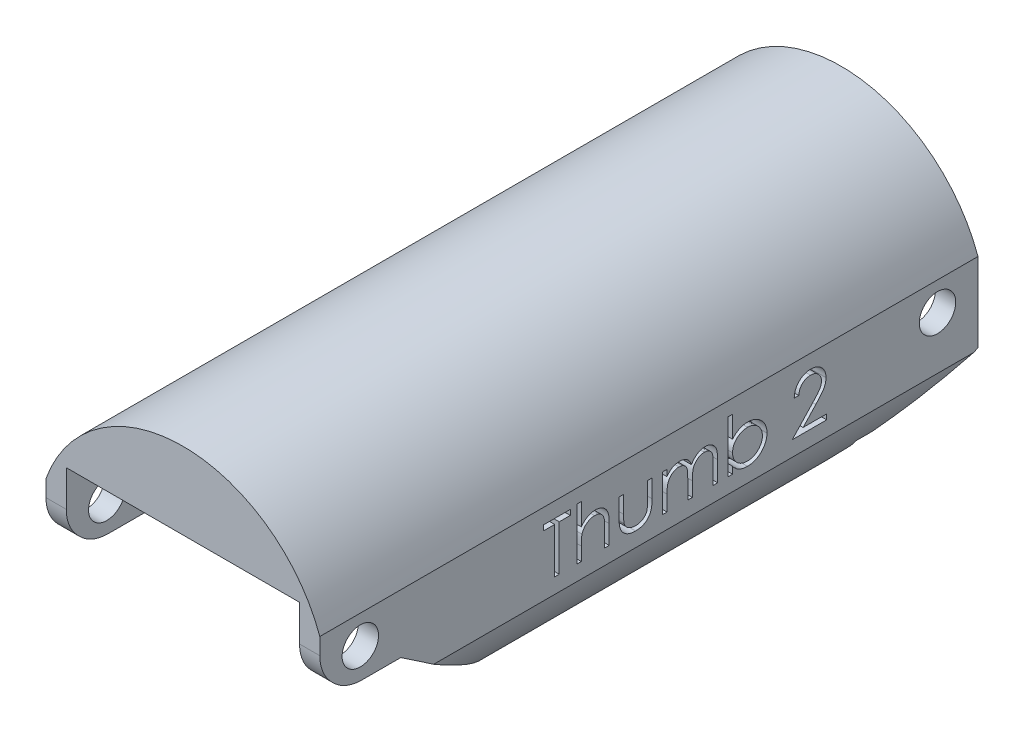
from build123d import *

# Parameters (mm, degrees)
BOSS_EXTRUDE1_DEPTH     = 20.6375
CUT_EXTRUDE1_DEPTH      = 30.060266989
CUT_EXTRUDE2_DEPTH      = 47.067541026
BOSS_EXTRUDE2_DEPTH     = 17.1704
SKETCH7_W               = 2.54
SKETCH7_H               = 2.8575
CUT_EXTRUDE3_DEPTH      = 2.54
SKETCH9_W               = 2.54
SKETCH9_H               = 3.81
CUT_EXTRUDE5_DEPTH      = 29.284043376
SKETCH11_W              = 2.54
SKETCH11_H              = 3.81
CUT_EXTRUDE8_DEPTH      = 3.81
CUT_EXTRUDE9_DEPTH      = 1.27
SKETCH13_W              = 3.81
SKETCH13_H              = 7.809132178
CUT_EXTRUDE10_DEPTH     = 3.81
SKETCH14_W              = 3.81
SKETCH14_H              = 6.35
CUT_EXTRUDE11_DEPTH     = 30.70423848
SKETCH10_R              = 0.889
CUT_EXTRUDE7_DEPTH      = 30.060266989
MIRROR4_COPY_1_SKETCH_W = 2.54
MIRROR4_COPY_1_SKETCH_H = 2.8575
MIRROR4_COPY_1_DEPTH    = 2.54
MIRROR4_COPY_2_SKETCH_W = 2.54
MIRROR4_COPY_2_SKETCH_H = 3.81
MIRROR4_COPY_2_DEPTH    = 29.284043376
MIRROR4_COPY_3_SKETCH_W = 2.54
MIRROR4_COPY_3_SKETCH_H = 3.81
MIRROR4_COPY_3_DEPTH    = 3.81
MIRROR4_COPY_4_DEPTH    = 1.27
MIRROR4_COPY_5_SKETCH_W = 3.81
MIRROR4_COPY_5_SKETCH_H = 7.809132178
MIRROR4_COPY_5_DEPTH    = 3.81
MIRROR4_COPY_6_SKETCH_W = 3.81
MIRROR4_COPY_6_SKETCH_H = 6.35
MIRROR4_COPY_6_DEPTH    = 30.70423848
CUT_EXTRUDE12_START     = -17.1704
CUT_EXTRUDE12_DEPTH     = 17.1704
SKETCH16_R              = 1.143
CUT_EXTRUDE13_DEPTH     = 30.060266989
CUT_EXTRUDE14_DEPTH     = 30.060266989
FILLET1_R               = 2.54
SKETCH21_W              = 14.6304
SKETCH21_H              = 7.62
CUT_EXTRUDE17_DEPTH     = 7.809132178
CUT_EXTRUDE18_START     = -1.184421
SKETCH22_W              = 7.0104
SKETCH22_H              = 2.54
CUT_EXTRUDE18_DEPTH     = 1.184421
SKETCH23_W              = 14.6304
SKETCH23_H              = 7.62
CUT_EXTRUDE19_DEPTH     = 0.1425
CUT_EXTRUDE20_DEPTH     = 16.51
SKETCH25_W              = 14.6304
SKETCH25_H              = 7.62
CUT_EXTRUDE21_DEPTH     = 6.623962162
CUT_EXTRUDE22_DEPTH     = 16.51
BOSS_EXTRUDE3_DEPTH     = 41.275
CUT_EXTRUDE24_START     = -33.382648
CUT_EXTRUDE24_DEPTH     = 33.858391
CUT_EXTRUDE23_DEPTH     = 1


with BuildPart() as part:
    # Sketch1 → Boss-Extrude1 (new, symmetric)
    with BuildSketch(Plane.XY):
        with BuildLine():
            Line((0, 0), (0, 5.08))
            ThreePointArc((0, 5.08), (8.5852, 11.1252), (17.1704, 5.08))
            Line((17.1704, 5.08), (17.1704, 0))
            ThreePointArc((17.1704, 0), (8.5852, -6.0452), (0, 0))
        make_face()
    extrude(amount=BOSS_EXTRUDE1_DEPTH, both=True)

    # Sketch2 → Cut-Extrude1 (cut, through all)
    with BuildSketch(Plane(origin=(0, 0, 0), x_dir=(0, 0, -1), z_dir=(1, 0, 0))):
        Polygon((-20.6375, -6.0452), (-20.6375, 0.635), (-3.81, -6.0452), align=None)
        Polygon((20.6375, 0.635), (20.6375, -6.0452), (6.31176487, -6.0452), align=None)
        with BuildLine():
            Line((-18.0975, 1.27), (-20.6375, 1.27))
            Line((-20.6375, 1.27), (-20.6375, 3.81))
            Line((-20.6375, 3.81), (-18.0975, 3.81))
            ThreePointArc((-18.0975, 3.81), (-13.357795474, 2.54), (-18.0975, 1.27))
        make_face()
        with BuildLine():
            Line((18.0975, 1.27), (20.6375, 1.27))
            Line((20.6375, 1.27), (20.6375, 3.81))
            Line((20.6375, 3.81), (18.0975, 3.81))
            ThreePointArc((18.0975, 3.81), (13.357795474, 2.54), (18.0975, 1.27))
        make_face()
    extrude(amount=CUT_EXTRUDE1_DEPTH, mode=Mode.SUBTRACT)

    # Sketch3 → Cut-Extrude2 (cut, through all)
    with BuildSketch(Plane.XY.offset(20.6375)):
        with BuildLine():
            ThreePointArc((5.495655228, -4.348331972), (8.5852, -1.905), (11.674744772, -4.348331972))
            ThreePointArc((11.674744772, -4.348331972), (8.5852, -4.9657), (5.495655228, -4.348331972))
        make_face()
    extrude(amount=-CUT_EXTRUDE2_DEPTH, mode=Mode.SUBTRACT)

    # Sketch4 → Boss-Extrude2 (add)
    with BuildSketch(Plane.ZY):
        with BuildLine():
            Line((20.6375, 1.27), (18.0975, 1.27))
            ThreePointArc((18.0975, 1.27), (17.167795474, 0.340295474), (15.897795474, 0))
            ThreePointArc((15.897795474, 0), (13.357795474, 2.54), (15.897795474, 5.08))
            ThreePointArc((15.897795474, 5.08), (17.167795474, 4.739704526), (18.0975, 3.81))
            Line((18.0975, 3.81), (20.6375, 3.81))
            Line((20.6375, 3.81), (20.6375, 1.27))
        make_face()
        with BuildLine():
            Line((-18.0975, 1.27), (-20.6375, 1.27))
            Line((-20.6375, 1.27), (-20.6375, 3.81))
            Line((-20.6375, 3.81), (-18.0975, 3.81))
            ThreePointArc((-18.0975, 3.81), (-17.167795474, 4.739704526), (-15.897795474, 5.08))
            ThreePointArc((-15.897795474, 5.08), (-13.357795474, 2.54), (-15.897795474, 0))
            ThreePointArc((-15.897795474, 0), (-17.167795474, 0.340295474), (-18.0975, 1.27))
        make_face()
    extrude(amount=-BOSS_EXTRUDE2_DEPTH)

    # Sketch7 → Cut-Extrude3 (cut)
    with BuildSketch(Plane.ZY.offset(-5.08)):
        with Locations((-19.3675, 1.42875)):
            Rectangle(SKETCH7_W, SKETCH7_H)
    cut_extrude3 = extrude(amount=CUT_EXTRUDE3_DEPTH, mode=Mode.SUBTRACT)

    # Sketch9 → Cut-Extrude5 (cut, through all)
    with BuildSketch(Plane.XZ.offset(-2.8575)):
        with Locations((3.81, -18.7325)):
            Rectangle(SKETCH9_W, SKETCH9_H)
    cut_extrude5 = extrude(amount=CUT_EXTRUDE5_DEPTH, mode=Mode.SUBTRACT)

    # Sketch11 → Cut-Extrude8 (cut)
    with BuildSketch(Plane.XZ.offset(-2.8575)):
        with Locations((3.81, -18.7325)):
            Rectangle(SKETCH11_W, SKETCH11_H)
    cut_extrude8 = extrude(amount=-CUT_EXTRUDE8_DEPTH, mode=Mode.SUBTRACT)

    # Sketch12 → Cut-Extrude9 (cut)
    with BuildSketch(Plane(origin=(2.54, 0, 0), x_dir=(0, 0, -1), z_dir=(1, 0, 0))):
        Polygon((16.8275, -1.141632178), (20.6375, 0.635), (20.6375, 6.6675), (16.8275, 6.6675), align=None)
    cut_extrude9 = extrude(amount=-CUT_EXTRUDE9_DEPTH, mode=Mode.SUBTRACT)

    # Sketch13 → Cut-Extrude10 (cut)
    with BuildSketch(Plane(origin=(0, 0, -16.8275), x_dir=(-1, 0, 0), z_dir=(0, 0, -1))):
        with Locations((-3.175, 2.762933911)):
            Rectangle(SKETCH13_W, SKETCH13_H)
    cut_extrude10 = extrude(amount=-CUT_EXTRUDE10_DEPTH, mode=Mode.SUBTRACT)

    # Sketch14 → Cut-Extrude11 (cut, through all)
    with BuildSketch(Plane.XZ.offset(-6.6675)):
        with Locations((3.175, -17.4625)):
            Rectangle(SKETCH14_W, SKETCH14_H)
    cut_extrude11 = extrude(amount=CUT_EXTRUDE11_DEPTH, mode=Mode.SUBTRACT)

    # Mirror3: Cut-Extrude3, Cut-Extrude5, Cut-Extrude8, Cut-Extrude9, Cut-Extrude10, Cut-Extrude11 across plane
    add(cut_extrude3.mirror(Plane(origin=(8.5852, 0, 0), x_dir=(0, 0, 1), z_dir=(1, 0, 0))), mode=Mode.SUBTRACT)
    add(cut_extrude5.mirror(Plane(origin=(8.5852, 0, 0), x_dir=(0, 0, 1), z_dir=(1, 0, 0))), mode=Mode.SUBTRACT)
    add(cut_extrude8.mirror(Plane(origin=(8.5852, 0, 0), x_dir=(0, 0, 1), z_dir=(1, 0, 0))), mode=Mode.SUBTRACT)
    add(cut_extrude9.mirror(Plane(origin=(8.5852, 0, 0), x_dir=(0, 0, 1), z_dir=(1, 0, 0))), mode=Mode.SUBTRACT)
    add(cut_extrude10.mirror(Plane(origin=(8.5852, 0, 0), x_dir=(0, 0, 1), z_dir=(1, 0, 0))), mode=Mode.SUBTRACT)
    add(cut_extrude11.mirror(Plane(origin=(8.5852, 0, 0), x_dir=(0, 0, 1), z_dir=(1, 0, 0))), mode=Mode.SUBTRACT)

    # Sketch10 → Cut-Extrude7 (cut, through all)
    with BuildSketch(Plane.ZY):
        with Locations((-18.0975, 3.81)):
            Circle(SKETCH10_R)
    cut_extrude7 = extrude(amount=-CUT_EXTRUDE7_DEPTH, mode=Mode.SUBTRACT)

    # Mirror4: Cut-Extrude3, Cut-Extrude5, Cut-Extrude8, Cut-Extrude9, Cut-Extrude10, Cut-Extrude11, Cut-Extrude7 across plane
    add(cut_extrude3.mirror(Plane(origin=(0, 0, 0), x_dir=(1, 0, 0), z_dir=(0, 0, -1))), mode=Mode.SUBTRACT)
    add(cut_extrude5.mirror(Plane(origin=(0, 0, 0), x_dir=(1, 0, 0), z_dir=(0, 0, -1))), mode=Mode.SUBTRACT)
    add(cut_extrude8.mirror(Plane(origin=(0, 0, 0), x_dir=(1, 0, 0), z_dir=(0, 0, -1))), mode=Mode.SUBTRACT)
    add(cut_extrude9.mirror(Plane(origin=(0, 0, 0), x_dir=(1, 0, 0), z_dir=(0, 0, -1))), mode=Mode.SUBTRACT)
    add(cut_extrude10.mirror(Plane(origin=(0, 0, 0), x_dir=(1, 0, 0), z_dir=(0, 0, -1))), mode=Mode.SUBTRACT)
    add(cut_extrude11.mirror(Plane(origin=(0, 0, 0), x_dir=(1, 0, 0), z_dir=(0, 0, -1))), mode=Mode.SUBTRACT)
    add(cut_extrude7.mirror(Plane(origin=(0, 0, 0), x_dir=(1, 0, 0), z_dir=(0, 0, -1))), mode=Mode.SUBTRACT)

    # Mirror4 copy 1 sketch → Mirror4 copy 1 (cut)
    with BuildSketch(Plane(origin=(12.0904, 0, 0), x_dir=(0, 0, -1), z_dir=(1, 0, 0))):
        with Locations((-19.3675, 1.42875)):
            Rectangle(MIRROR4_COPY_1_SKETCH_W, MIRROR4_COPY_1_SKETCH_H)
    extrude(amount=MIRROR4_COPY_1_DEPTH, mode=Mode.SUBTRACT)

    # Mirror4 copy 2 sketch → Mirror4 copy 2 (cut, through all)
    with BuildSketch(Plane(origin=(17.1704, 2.8575, 0), x_dir=(-1, 0, 0), z_dir=(0, -1, 0))):
        with Locations((3.81, -18.7325)):
            Rectangle(MIRROR4_COPY_2_SKETCH_W, MIRROR4_COPY_2_SKETCH_H)
    extrude(amount=MIRROR4_COPY_2_DEPTH, mode=Mode.SUBTRACT)

    # Mirror4 copy 3 sketch → Mirror4 copy 3 (cut)
    with BuildSketch(Plane(origin=(17.1704, 2.8575, 0), x_dir=(-1, 0, 0), z_dir=(0, -1, 0))):
        with Locations((3.81, -18.7325)):
            Rectangle(MIRROR4_COPY_3_SKETCH_W, MIRROR4_COPY_3_SKETCH_H)
    extrude(amount=-MIRROR4_COPY_3_DEPTH, mode=Mode.SUBTRACT)

    # Mirror4 copy 4 sketch → Mirror4 copy 4 (cut)
    with BuildSketch(Plane.ZY.offset(-14.6304)):
        Polygon((16.8275, -1.141632178), (20.6375, 0.635), (20.6375, 6.6675), (16.8275, 6.6675), align=None)
    extrude(amount=-MIRROR4_COPY_4_DEPTH, mode=Mode.SUBTRACT)

    # Mirror4 copy 5 sketch → Mirror4 copy 5 (cut)
    with BuildSketch(Plane(origin=(17.1704, 0, 16.8275), x_dir=(1, 0, 0), z_dir=(0, 0, 1))):
        with Locations((-3.175, 2.762933911)):
            Rectangle(MIRROR4_COPY_5_SKETCH_W, MIRROR4_COPY_5_SKETCH_H)
    extrude(amount=-MIRROR4_COPY_5_DEPTH, mode=Mode.SUBTRACT)

    # Mirror4 copy 6 sketch → Mirror4 copy 6 (cut, through all)
    with BuildSketch(Plane(origin=(17.1704, 6.6675, 0), x_dir=(-1, 0, 0), z_dir=(0, -1, 0))):
        with Locations((3.175, -17.4625)):
            Rectangle(MIRROR4_COPY_6_SKETCH_W, MIRROR4_COPY_6_SKETCH_H)
    extrude(amount=MIRROR4_COPY_6_DEPTH, mode=Mode.SUBTRACT)

    # Sketch15 → Cut-Extrude12 (cut)
    with BuildSketch(Plane.ZY.offset(CUT_EXTRUDE12_START)):
        Polygon((15.5575, 1.905), (20.6375, 1.905), (20.6375, -6.0452), (3.81, -6.0452), align=None)
    cut_extrude12 = extrude(amount=CUT_EXTRUDE12_DEPTH, mode=Mode.SUBTRACT)

    # Mirror5: Cut-Extrude12 across plane
    add(cut_extrude12.mirror(Plane(origin=(8.5852, 0, 0), x_dir=(0, 0, 1), z_dir=(1, 0, 0))), mode=Mode.SUBTRACT)

    # Sketch16 → Cut-Extrude13 (cut, through all)
    with BuildSketch(Plane(origin=(17.1704, 0, 0), x_dir=(0, 0, -1), z_dir=(1, 0, 0))):
        with Locations((-18.0975, 3.81)):
            Circle(SKETCH16_R)
        with Locations((18.0975, 3.81)):
            Circle(SKETCH16_R)
    extrude(amount=-CUT_EXTRUDE13_DEPTH, mode=Mode.SUBTRACT)

    # Sketch17 → Cut-Extrude14 (cut, through all)
    with BuildSketch(Plane(origin=(17.1704, 0, 0), x_dir=(0, 0, -1), z_dir=(1, 0, 0))):
        Polygon((-20.6375, 3.4925), (-19.05, 1.905), (-20.6375, 1.905), align=None)
    extrude(amount=-CUT_EXTRUDE14_DEPTH, mode=Mode.SUBTRACT)

    # Fillet1
    fillet1_edges = [part.edges().sort_by_distance(p)[0] for p in [
        (16.5354, 1.905, 19.05),
        (0.635, 1.905, 19.05),
        (0.635, 3.4925, 20.6375),
        (16.5354, 3.4925, 20.6375),
    ]]
    fillet(fillet1_edges, radius=FILLET1_R)

    # Sketch21 → Cut-Extrude17 (cut)
    with BuildSketch(Plane(origin=(0, -1.141632178, 0), x_dir=(1, 0, 0), z_dir=(0, 1, 0))):
        with Locations((8.5852, 16.8275)):
            Rectangle(SKETCH21_W, SKETCH21_H)
    extrude(amount=CUT_EXTRUDE17_DEPTH, mode=Mode.SUBTRACT)

    # Sketch22 → Cut-Extrude18 (cut)
    with BuildSketch(Plane(origin=(0, -1.141632178, 0), x_dir=(1, 0, 0), z_dir=(0, 1, 0)).offset(CUT_EXTRUDE18_START)):
        with Locations((8.5852, 15.5575)):
            Rectangle(SKETCH22_W, SKETCH22_H)
    extrude(amount=CUT_EXTRUDE18_DEPTH, mode=Mode.SUBTRACT)

    # Sketch23 → Cut-Extrude19 (cut)
    with BuildSketch(Plane.XZ.offset(-6.6675)):
        with Locations((8.5852, -16.8275)):
            Rectangle(SKETCH23_W, SKETCH23_H)
    extrude(amount=-CUT_EXTRUDE19_DEPTH, mode=Mode.SUBTRACT)

    # Sketch24 → Cut-Extrude20 (cut)
    with BuildSketch(Plane(origin=(0, 0, -13.0175), x_dir=(-1, 0, 0), z_dir=(0, 0, -1))):
        with BuildLine():
            Line((-6.604, 6.2636968), (-5.588, 6.2636968))
            ThreePointArc((-5.588, 6.2636968), (-5.207, 5.8826968), (-5.588, 5.5016968))
            Line((-5.588, 5.5016968), (-6.604, 5.5016968))
            ThreePointArc((-6.604, 5.5016968), (-6.985, 5.8826968), (-6.604, 6.2636968))
        make_face()
    extrude(amount=-CUT_EXTRUDE20_DEPTH, mode=Mode.SUBTRACT)

    # Sketch25 → Cut-Extrude21 (cut)
    with BuildSketch(Plane(origin=(0, 0.186037838, 0), x_dir=(-1, 0, 0), z_dir=(0, -1, 0))):
        with Locations((-8.5852, -16.8275)):
            Rectangle(SKETCH25_W, SKETCH25_H)
    extrude(amount=-CUT_EXTRUDE21_DEPTH, mode=Mode.SUBTRACT)

    # Sketch26 → Cut-Extrude22 (cut)
    with BuildSketch(Plane.XY.offset(13.0175)):
        with BuildLine():
            Line((11.7094, 5.5016968), (10.6934, 5.5016968))
            ThreePointArc((10.6934, 5.5016968), (10.3124, 5.8826968), (10.6934, 6.2636968))
            Line((10.6934, 6.2636968), (11.7094, 6.2636968))
            ThreePointArc((11.7094, 6.2636968), (12.0904, 5.8826968), (11.7094, 5.5016968))
        make_face()
    extrude(amount=-CUT_EXTRUDE22_DEPTH, mode=Mode.SUBTRACT)

    # Sketch28 → Boss-Extrude3 (add)
    with BuildSketch(Plane.XY.offset(20.6375)):
        with BuildLine():
            Line((17.1704, 5.08), (17.1704, 5.588))
            ThreePointArc((17.1704, 5.588), (16.377038219, 7.251475938), (15.2654, 8.721454027))
            ThreePointArc((15.2654, 8.721454027), (8.5852, 11.6332), (1.905, 8.721454027))
            ThreePointArc((1.905, 8.721454027), (0.793361781, 7.251475938), (0, 5.588))
            Line((0, 5.588), (0, 5.08))
            ThreePointArc((0, 5.08), (8.5852, 11.1252), (17.1704, 5.08))
        make_face()
    extrude(amount=-BOSS_EXTRUDE3_DEPTH)

    # Sketch29 → Cut-Extrude24 (cut)
    with BuildSketch(Plane.XY.offset(13.0175).offset(CUT_EXTRUDE24_START)):
        with BuildLine():
            Line((0, 0), (0, 0.508))
            ThreePointArc((0, 0.508), (0.793361781, -1.155475938), (1.905, -2.625454027))
            ThreePointArc((1.905, -2.625454027), (8.5852, -5.5372), (15.2654, -2.625454027))
            ThreePointArc((15.2654, -2.625454027), (16.377038219, -1.155475938), (17.1704, 0.508))
            Line((17.1704, 0.508), (17.1704, 0))
            ThreePointArc((17.1704, 0), (8.5852, -6.0452), (0, 0))
        make_face()
    extrude(amount=CUT_EXTRUDE24_DEPTH, mode=Mode.SUBTRACT)

    # Sketch27 → Cut-Extrude23 (cut)
    # profile 1 of 6: a face of its own
    with BuildSketch(Plane(origin=(17.1704, 0, 0), x_dir=(0, 0, -1), z_dir=(1, 0, 0))):
        Polygon((-6.599270706, 4.310775781), (-6.599270706, 4.636416806), (-4.930360449, 4.636416806), (-4.930360449, 4.310775781), (-5.622347629, 4.310775781), (-5.622347629, 1.461416806), (-5.907283526, 1.461416806), (-5.907283526, 4.310775781), align=None)
    # profile 2 of 6: a face of its own
    with BuildSketch(Plane(origin=(17.1704, 0, 0), x_dir=(0, 0, -1), z_dir=(1, 0, 0))):
        with BuildLine():
            Line((-4.523309167, 4.717827063), (-4.23837327, 4.717827063))
            Line((-4.23837327, 4.717827063), (-4.23837327, 3.343392968))
            add(Edge.make_bspline(
                [(-4.23837327, 3.343392968), (-4.207786861, 3.38162358), (-4.148233554, 3.456060542), (-4.047997791, 3.553180336), (-3.9450635, 3.637361943), (-3.835875423, 3.704373), (-3.722436736, 3.757310722), (-3.604269002, 3.794855229), (-3.481350264, 3.81794301), (-3.397870306, 3.820844432), (-3.355580802, 3.822314242)],
                knots=[0, 0, 0, 0, 1.125788106, 2.19196713, 3.20547328, 4.180437432, 5.132270164, 6.079753143, 7.027236121, 8, 8, 8, 8], degree=3))
            add(Edge.make_bspline(
                [(-3.355580802, 3.822314242), (-3.312645374, 3.820730887), (-3.228610385, 3.817631881), (-3.10625363, 3.793126885), (-2.991989122, 3.751255495), (-2.886156536, 3.693953979), (-2.791065561, 3.622586486), (-2.70683756, 3.540189319), (-2.638039121, 3.444690836), (-2.591231351, 3.35646552), (-2.560775474, 3.277962507), (-2.541497031, 3.210619386), (-2.525151044, 3.135578793), (-2.510909141, 3.052879357), (-2.501417178, 2.962124094), (-2.493792989, 2.863722449), (-2.488371491, 2.757680064), (-2.488161393, 2.684273837), (-2.488052757, 2.646317648)],
                knots=[0, 0, 0, 0, 1.235656852, 2.418478516, 3.575258207, 4.727955599, 5.870717718, 6.98870536, 8.107142894, 9.245821548, 9.854588956, 10.528768408, 11.260415777, 12.065282286, 12.943670737, 13.886611085, 14.907229059, 16, 16, 16, 16], degree=3))
            Line((-2.488052757, 2.646317648), (-2.488052757, 1.461416806))
            Line((-2.488052757, 1.461416806), (-2.772988654, 1.461416806))
            Line((-2.772988654, 1.461416806), (-2.772988654, 2.552823056))
            add(Edge.make_bspline(
                [(-2.772988654, 2.552823056), (-2.773161287, 2.584412192), (-2.773491503, 2.644836833), (-2.774583108, 2.731347517), (-2.777019889, 2.809811868), (-2.780957638, 2.879978417), (-2.785099024, 2.941944986), (-2.79079889, 2.995621585), (-2.797430317, 3.041081938), (-2.80338914, 3.068445566), (-2.806061571, 3.080717688)],
                knots=[0, 0, 0, 0, 1.430932559, 2.737130458, 3.918967929, 4.986496826, 5.920444988, 6.731744033, 7.431208747, 8, 8, 8, 8], degree=3))
            add(Edge.make_bspline(
                [(-2.806061571, 3.080717688), (-2.816424993, 3.116726055), (-2.836348613, 3.185951933), (-2.88265642, 3.279988547), (-2.940494952, 3.360166134), (-3.011113539, 3.425402667), (-3.093262912, 3.476575992), (-3.187478737, 3.512016051), (-3.292874285, 3.534012199), (-3.367125263, 3.536224996), (-3.405826195, 3.537378345)],
                knots=[0, 0, 0, 0, 1.090059168, 2.095632401, 3.037101401, 3.955032261, 4.878929692, 5.839099886, 6.873700383, 8, 8, 8, 8], degree=3))
            add(Edge.make_bspline(
                [(-3.405826195, 3.537378345), (-3.428747675, 3.536946702), (-3.474108691, 3.536092493), (-3.541372124, 3.527516456), (-3.60662206, 3.513502262), (-3.670486893, 3.494538859), (-3.731613079, 3.468734693), (-3.791782345, 3.438862307), (-3.849289949, 3.402296962), (-3.905157083, 3.36127073), (-3.957152274, 3.315850305), (-4.005527586, 3.267910567), (-4.048651652, 3.216861135), (-4.087721016, 3.16352103), (-4.121447033, 3.107158618), (-4.150886614, 3.048317414), (-4.175865424, 2.986920039), (-4.188277581, 2.944306948), (-4.194488054, 2.922985316)],
                knots=[0, 0, 0, 0, 1.024319606, 2.027102035, 3.025350316, 4.005802111, 5.00026367, 5.987881639, 7.005602596, 8.042517216, 9.083927026, 10.089214625, 11.084353441, 12.06828073, 13.041928858, 14.016821737, 15.00770877, 16, 16, 16, 16], degree=3))
            add(Edge.make_bspline(
                [(-4.194488054, 2.922985316), (-4.198061677, 2.907544882), (-4.205849042, 2.873898276), (-4.214298926, 2.818404425), (-4.221862499, 2.75391893), (-4.22825654, 2.6805396), (-4.232178197, 2.597997544), (-4.236403887, 2.506856031), (-4.237976886, 2.406544155), (-4.238237193, 2.336788945), (-4.23837327, 2.300324058)],
                knots=[0, 0, 0, 0, 0.607992626, 1.324890765, 2.152360218, 3.099583803, 4.150613268, 5.323148443, 6.60066238, 8, 8, 8, 8], degree=3))
            Line((-4.23837327, 2.300324058), (-4.23837327, 1.461416806))
            Line((-4.23837327, 1.461416806), (-4.523309167, 1.461416806))
            Line((-4.523309167, 1.461416806), (-4.523309167, 4.717827063))
        make_face()
    # profile 3 of 6: a face of its own
    with BuildSketch(Plane(origin=(17.1704, 0, 0), x_dir=(0, 0, -1), z_dir=(1, 0, 0))):
        with BuildLine():
            Line((-1.877475834, 3.781609114), (-1.592539937, 3.781609114))
            Line((-1.592539937, 3.781609114), (-1.592539937, 2.705467287))
            add(Edge.make_bspline(
                [(-1.592539937, 2.705467287), (-1.592411209, 2.673878079), (-1.592164958, 2.613449403), (-1.590494961, 2.526495055), (-1.586566948, 2.447195609), (-1.581655836, 2.375505255), (-1.575340184, 2.311436121), (-1.567825992, 2.25521199), (-1.559427281, 2.206195266), (-1.551206105, 2.176673793), (-1.547382685, 2.16294425)],
                knots=[0, 0, 0, 0, 1.388932606, 2.656963016, 3.823490214, 4.879454478, 5.816252168, 6.653371382, 7.373723809, 8, 8, 8, 8], degree=3))
            add(Edge.make_bspline(
                [(-1.547382685, 2.16294425), (-1.541249079, 2.145687789), (-1.529109384, 2.111533623), (-1.507089867, 2.062195026), (-1.479849876, 2.016497448), (-1.450041318, 1.972678753), (-1.415661141, 1.932036951), (-1.377144335, 1.894640673), (-1.33578022, 1.859076962), (-1.274316734, 1.816999329), (-1.190261543, 1.771900422), (-1.079905115, 1.732987787), (-0.960249139, 1.709732436), (-0.877549715, 1.707034362), (-0.835042941, 1.705647575)],
                knots=[0, 0, 0, 0, 0.725840625, 1.436591201, 2.137033971, 2.831655856, 3.53531722, 4.242432219, 4.957935707, 5.694543706, 7.190802206, 8.724350549, 10.316345118, 12, 12, 12, 12], degree=3))
            add(Edge.make_bspline(
                [(-0.835042941, 1.705647575), (-0.792540116, 1.707063851), (-0.710305015, 1.709804082), (-0.591963721, 1.732286292), (-0.483785652, 1.769847167), (-0.386856575, 1.822286748), (-0.301616134, 1.886459905), (-0.23058284, 1.961760753), (-0.171974831, 2.045806982), (-0.146384856, 2.108512578), (-0.133515497, 2.140047615)],
                knots=[0, 0, 0, 0, 1.157059328, 2.238695713, 3.266970494, 4.264342957, 5.228770407, 6.160125903, 7.074715775, 8, 8, 8, 8], degree=3))
            add(Edge.make_bspline(
                [(-0.133515497, 2.140047615), (-0.129710732, 2.152717044), (-0.121299324, 2.180726055), (-0.112262048, 2.228241969), (-0.104120929, 2.284906289), (-0.097169333, 2.351089807), (-0.09221165, 2.426619567), (-0.089539183, 2.511471965), (-0.086519962, 2.605380627), (-0.086474136, 2.671119237), (-0.086450193, 2.705467287)],
                knots=[0, 0, 0, 0, 0.557542046, 1.232589297, 2.036731608, 2.971723315, 4.038036528, 5.22795436, 6.551621927, 8, 8, 8, 8], degree=3))
            Line((-0.086450193, 2.705467287), (-0.086450193, 3.781609114))
            Line((-0.086450193, 3.781609114), (0.198485704, 3.781609114))
            Line((0.198485704, 3.781609114), (0.198485704, 2.652041806))
            add(Edge.make_bspline(
                [(0.198485704, 2.652041806), (0.198085024, 2.613663158), (0.19730765, 2.53920333), (0.192311702, 2.4309956), (0.183739554, 2.330155564), (0.170728689, 2.236629843), (0.155429113, 2.150489842), (0.135693066, 2.071625159), (0.112127093, 2.000278778), (0.085542804, 1.935198737), (0.054135824, 1.876191912), (0.020728456, 1.820188707), (-0.017847587, 1.768578687), (-0.058460586, 1.718792748), (-0.103637802, 1.67330722), (-0.152532674, 1.631078381), (-0.204457005, 1.591460702), (-0.260563063, 1.555999327), (-0.320031777, 1.524052799), (-0.382936562, 1.495735357), (-0.450047896, 1.47332659), (-0.520499909, 1.453994772), (-0.594637774, 1.438832361), (-0.672390016, 1.428140261), (-0.753730446, 1.421585854), (-0.809165456, 1.421007963), (-0.837587012, 1.420711678)],
                knots=[0, 0, 0, 0, 1.493040784, 2.896703357, 4.213163133, 5.428574705, 6.569057535, 7.615249723, 8.588095153, 9.490268104, 10.346124644, 11.18633936, 12.024365274, 12.850166724, 13.684164916, 14.514361689, 15.362232829, 16.222528818, 17.093394965, 17.986930858, 18.902426812, 19.842810585, 20.827885679, 21.843828298, 22.894529745, 24, 24, 24, 24], degree=3))
            add(Edge.make_bspline(
                [(-0.837587012, 1.420711678), (-0.865795993, 1.421019841), (-0.921229266, 1.42162541), (-1.002573894, 1.42810405), (-1.080541559, 1.438815747), (-1.154855063, 1.454105837), (-1.22558898, 1.473191279), (-1.293029827, 1.495873058), (-1.356387916, 1.524067495), (-1.416424448, 1.555797136), (-1.472669472, 1.591688493), (-1.525382253, 1.631029501), (-1.574492112, 1.673761429), (-1.620009881, 1.719705818), (-1.661296653, 1.76943261), (-1.698866919, 1.822541797), (-1.733299073, 1.878507148), (-1.764461962, 1.938435874), (-1.79123334, 2.004269055), (-1.81486917, 2.077109993), (-1.834200963, 2.157757276), (-1.84993306, 2.246141954), (-1.862589009, 2.341841027), (-1.871375724, 2.44540809), (-1.876288656, 2.556590868), (-1.877071576, 2.633380411), (-1.877475834, 2.673030388)],
                knots=[0, 0, 0, 0, 1.083640291, 2.129454052, 3.13281866, 4.105697902, 5.042300162, 5.946461698, 6.836384745, 7.703652036, 8.553297018, 9.397182691, 10.228592656, 11.052265423, 11.879314572, 12.708807002, 13.549817954, 14.402308542, 15.300838682, 16.27712199, 17.341985831, 18.484375296, 19.725102775, 21.0496083, 22.476576903, 24, 24, 24, 24], degree=3))
            Line((-1.877475834, 2.673030388), (-1.877475834, 3.781609114))
        make_face()
    # profile 4 of 6: a face of its own
    with BuildSketch(Plane(origin=(17.1704, 0, 0), x_dir=(0, 0, -1), z_dir=(1, 0, 0))):
        with BuildLine():
            Line((0.849767756, 3.781609114), (1.134703653, 3.781609114))
            Line((1.134703653, 3.781609114), (1.134703653, 3.378373938))
            add(Edge.make_bspline(
                [(1.134703653, 3.378373938), (1.160361236, 3.413650548), (1.209523625, 3.481243915), (1.290137467, 3.57031653), (1.370670084, 3.64590707), (1.428666794, 3.685588104), (1.456528573, 3.704650981)],
                knots=[0, 0, 0, 0, 1.134379233, 2.173579362, 3.122582517, 4, 4, 4, 4], degree=3))
            add(Edge.make_bspline(
                [(1.456528573, 3.704650981), (1.494505802, 3.722798705), (1.569796754, 3.758777091), (1.689012765, 3.795274677), (1.811000501, 3.817703876), (1.893376524, 3.820771265), (1.934813829, 3.822314242)],
                knots=[0, 0, 0, 0, 1.014936303, 2.012140481, 3.000054389, 4, 4, 4, 4], degree=3))
            add(Edge.make_bspline(
                [(1.934813829, 3.822314242), (1.962838191, 3.821366014), (2.018296895, 3.819489522), (2.100469605, 3.807279347), (2.180169917, 3.786173604), (2.256926929, 3.756775532), (2.329244974, 3.72117318), (2.395547318, 3.679399516), (2.455077849, 3.632502884), (2.507806482, 3.578365566), (2.555221955, 3.515467366), (2.598836337, 3.44211194), (2.639136351, 3.356652133), (2.661471396, 3.294633914), (2.673230296, 3.261982712)],
                knots=[0, 0, 0, 0, 1.009824226, 1.998387844, 2.986035974, 3.974953746, 4.955485308, 5.885931332, 6.793869504, 7.679848016, 8.601185859, 9.625726857, 10.749998409, 12, 12, 12, 12], degree=3))
            add(Edge.make_bspline(
                [(2.673230296, 3.261982712), (2.68566836, 3.284411292), (2.710144722, 3.328547588), (2.751243407, 3.391011869), (2.79430348, 3.44943803), (2.839691913, 3.50387243), (2.887248502, 3.554046256), (2.937197058, 3.600125396), (2.989253253, 3.642307732), (3.061636213, 3.691586599), (3.155809079, 3.743929813), (3.274543297, 3.789312759), (3.398050953, 3.817358104), (3.481887008, 3.82065128), (3.524221882, 3.822314242)],
                knots=[0, 0, 0, 0, 0.86119277, 1.694706429, 2.50939023, 3.298075842, 4.073795165, 4.829715201, 5.57930267, 6.321991688, 7.768977793, 9.186738141, 10.579381044, 12, 12, 12, 12], degree=3))
            add(Edge.make_bspline(
                [(3.524221882, 3.822314242), (3.563121495, 3.820847192), (3.639251814, 3.817976032), (3.750084048, 3.795430381), (3.853445543, 3.756715658), (3.949128319, 3.703889431), (4.035451864, 3.637505457), (4.110487373, 3.558521583), (4.17377906, 3.467496489), (4.215125397, 3.381869471), (4.243169958, 3.306272419), (4.260461221, 3.241859569), (4.27573723, 3.170964946), (4.288420217, 3.09350378), (4.297689903, 3.009202443), (4.304557624, 2.918198891), (4.309205891, 2.820422397), (4.309534342, 2.752962265), (4.309703653, 2.71818764)],
                knots=[0, 0, 0, 0, 1.209669288, 2.367440248, 3.500751976, 4.631527125, 5.755587489, 6.87532382, 8.007944318, 9.190864318, 9.82315674, 10.514484317, 11.263564316, 12.079023757, 12.955305781, 13.901327259, 14.918167583, 16, 16, 16, 16], degree=3))
            Line((4.309703653, 2.71818764), (4.309703653, 1.461416806))
            Line((4.309703653, 1.461416806), (4.024767756, 1.461416806))
            Line((4.024767756, 1.461416806), (4.024767756, 2.719459675))
            add(Edge.make_bspline(
                [(4.024767756, 2.719459675), (4.024697105, 2.74914191), (4.024561324, 2.806186651), (4.022117816, 2.888058518), (4.017513781, 2.96268767), (4.012130216, 3.02997235), (4.004651903, 3.090069465), (3.994994522, 3.142858302), (3.984764055, 3.188754117), (3.967767835, 3.239632174), (3.940600819, 3.295757294), (3.899219248, 3.356285109), (3.847085651, 3.408972692), (3.786887509, 3.454709308), (3.718354277, 3.491896397), (3.642821278, 3.51845392), (3.56075746, 3.534893959), (3.503949645, 3.536532274), (3.474612507, 3.537378345)],
                knots=[0, 0, 0, 0, 1.253487763, 2.409012846, 3.458416907, 4.410876679, 5.259312806, 6.014470957, 6.676830364, 7.243083969, 8.276244668, 9.299465089, 10.325150304, 11.392391894, 12.482080715, 13.603491619, 14.762376348, 16, 16, 16, 16], degree=3))
            add(Edge.make_bspline(
                [(3.474612507, 3.537378345), (3.438626192, 3.536093688), (3.367503551, 3.533554717), (3.263685145, 3.507634132), (3.163925723, 3.46855419), (3.071201995, 3.411919033), (2.985905357, 3.34405716), (2.912517883, 3.26336717), (2.851891543, 3.17208145), (2.810839722, 3.087584084), (2.784905141, 3.011683946), (2.767781082, 2.945374187), (2.754461148, 2.870007336), (2.741969311, 2.786089827), (2.733816158, 2.69304402), (2.726406277, 2.591300328), (2.722940209, 2.480552736), (2.722455379, 2.40378424), (2.722203653, 2.363925821)],
                knots=[0, 0, 0, 0, 1.090531906, 2.155305635, 3.229839962, 4.33261226, 5.44038871, 6.529323825, 7.629011124, 8.757537029, 9.370236727, 10.061839251, 10.834451254, 11.692844982, 12.636905849, 13.66920014, 14.789842145, 16, 16, 16, 16], degree=3))
            Line((2.722203653, 2.363925821), (2.722203653, 1.461416806))
            Line((2.722203653, 1.461416806), (2.437267756, 1.461416806))
            Line((2.437267756, 1.461416806), (2.437267756, 2.641229507))
            add(Edge.make_bspline(
                [(2.437267756, 2.641229507), (2.437195701, 2.674515589), (2.437057073, 2.738554665), (2.434629271, 2.83038807), (2.430014979, 2.913918764), (2.424680481, 2.989049664), (2.417005891, 3.055644226), (2.408288464, 3.114059471), (2.397993653, 3.164148952), (2.380948543, 3.219088594), (2.354900418, 3.279614003), (2.313001066, 3.344149072), (2.260742761, 3.400635132), (2.199446324, 3.448857711), (2.130498312, 3.488718912), (2.05431337, 3.51743883), (1.971577485, 3.534152292), (1.914538423, 3.536282714), (1.885204454, 3.537378345)],
                knots=[0, 0, 0, 0, 1.320475261, 2.540461679, 3.643808994, 4.639130445, 5.527981419, 6.302341397, 6.981980563, 7.553956391, 8.582137848, 9.585246428, 10.591171744, 11.620968678, 12.668337649, 13.738356861, 14.836885341, 16, 16, 16, 16], degree=3))
            add(Edge.make_bspline(
                [(1.885204454, 3.537378345), (1.85071832, 3.535989999), (1.781988678, 3.533223075), (1.681021891, 3.508318126), (1.583517021, 3.469307287), (1.491029544, 3.415187308), (1.40605371, 3.348150287), (1.331660496, 3.26930606), (1.269119776, 3.179635865), (1.227634487, 3.096029483), (1.200875157, 3.022030869), (1.183099389, 2.959119652), (1.167823443, 2.889269427), (1.156471437, 2.81226469), (1.145512775, 2.728606984), (1.140223852, 2.637879554), (1.135078934, 2.540160231), (1.134831815, 2.472693708), (1.134703653, 2.437703865)],
                knots=[0, 0, 0, 0, 1.098833095, 2.189935336, 3.297829714, 4.440610912, 5.596351641, 6.740013378, 7.886572111, 9.072425424, 9.705826452, 10.395263256, 11.156850408, 11.985370555, 12.878090359, 13.847760091, 14.883794034, 16, 16, 16, 16], degree=3))
            Line((1.134703653, 2.437703865), (1.134703653, 1.461416806))
            Line((1.134703653, 1.461416806), (0.849767756, 1.461416806))
            Line((0.849767756, 1.461416806), (0.849767756, 3.781609114))
        make_face()
    # profile 5 of 6: a face of its own
    with BuildSketch(Plane(origin=(17.1704, 0, 0), x_dir=(0, 0, -1), z_dir=(1, 0, 0))):
        with BuildLine():
            Line((4.960985704, 1.461416806), (4.960985704, 4.717827063))
            Line((4.960985704, 4.717827063), (5.245921602, 4.717827063))
            Line((5.245921602, 4.717827063), (5.245921602, 3.360565444))
            add(Edge.make_bspline(
                [(5.245921602, 3.360565444), (5.278028489, 3.397538711), (5.34067035, 3.469675078), (5.44569613, 3.563879732), (5.555828326, 3.643755908), (5.671904743, 3.709601887), (5.794090476, 3.759742945), (5.921754603, 3.796411827), (6.055223476, 3.818534232), (6.146227298, 3.821043455), (6.192315833, 3.822314242)],
                knots=[0, 0, 0, 0, 1.077089805, 2.101446609, 3.097517232, 4.067117542, 5.031729543, 5.997785507, 6.985986182, 8, 8, 8, 8], degree=3))
            add(Edge.make_bspline(
                [(6.192315833, 3.822314242), (6.233287972, 3.821189178), (6.314296874, 3.818964734), (6.433388536, 3.802060585), (6.547972721, 3.774648722), (6.657987059, 3.736646531), (6.762918208, 3.68622483), (6.863664638, 3.625862358), (6.959710188, 3.553981873), (7.04956712, 3.471796263), (7.132383717, 3.382572755), (7.20487578, 3.287159184), (7.266107647, 3.186942494), (7.316754605, 3.082258152), (7.355916918, 2.972678605), (7.382897403, 2.858311296), (7.400036474, 2.739268736), (7.402195697, 2.658249265), (7.403293397, 2.617060837)],
                knots=[0, 0, 0, 0, 1.034377878, 2.045141349, 3.03070803, 4.00595497, 4.978199603, 5.965204761, 6.967410914, 8.002051993, 9.036360596, 10.037508045, 11.022711142, 11.997267194, 12.969246472, 13.954813154, 14.960274251, 16, 16, 16, 16], degree=3))
            add(Edge.make_bspline(
                [(7.403293397, 2.617060837), (7.402171769, 2.576511535), (7.399960094, 2.496554698), (7.383067908, 2.378892322), (7.355176653, 2.265645787), (7.31529758, 2.157107725), (7.265164386, 2.052768233), (7.202470586, 1.953816723), (7.130070607, 1.858531367), (7.046313066, 1.769972787), (6.9556772, 1.688118202), (6.858690708, 1.616992882), (6.757796536, 1.55556378), (6.651422142, 1.506890624), (6.541142561, 1.467519788), (6.425776317, 1.44019874), (6.305976103, 1.424257469), (6.224588255, 1.421902919), (6.183411586, 1.420711678)],
                knots=[0, 0, 0, 0, 1.024244038, 2.01964794, 2.996620209, 3.965911562, 4.936179293, 5.91563013, 6.920572822, 7.955171681, 8.990768464, 10.002129126, 10.989675881, 11.969873457, 12.952483066, 13.943799762, 14.959703725, 16, 16, 16, 16], degree=3))
            add(Edge.make_bspline(
                [(6.183411586, 1.420711678), (6.136271805, 1.422018515), (6.043838915, 1.424580996), (5.908626855, 1.445825356), (5.780645735, 1.481985531), (5.658437673, 1.530573695), (5.543749667, 1.596367545), (5.435853568, 1.677971169), (5.335429794, 1.776729214), (5.276268826, 1.852077851), (5.245921602, 1.890728705)],
                knots=[0, 0, 0, 0, 1.035807596, 2.031038093, 2.998900396, 3.954262848, 4.914341711, 5.895762244, 6.92060972, 8, 8, 8, 8], degree=3))
            Line((5.245921602, 1.890728705), (5.245921602, 1.461416806))
            Line((5.245921602, 1.461416806), (4.960985704, 1.461416806))
        make_face()
        with BuildLine():
            add(Edge.make_bspline(
                [(6.180867515, 1.705647575), (6.222518392, 1.70712951), (6.304730598, 1.710054614), (6.425420323, 1.732890686), (6.540912498, 1.770885561), (6.650625152, 1.822850068), (6.752841385, 1.888184342), (6.844147703, 1.967238368), (6.925318582, 2.057500456), (6.993038407, 2.15931245), (7.049577215, 2.267671543), (7.088414973, 2.381657945), (7.114467863, 2.498221075), (7.117055305, 2.577274987), (7.118357499, 2.617060837)],
                knots=[0, 0, 0, 0, 1.031910345, 2.036826888, 3.032245421, 4.038315463, 5.03827337, 6.029480047, 7.023177075, 8.037597977, 9.052889626, 10.043399556, 11.015292101, 12, 12, 12, 12], degree=3))
            add(Edge.make_bspline(
                [(7.118357499, 2.617060837), (7.116645046, 2.656807793), (7.113226976, 2.736143024), (7.08930128, 2.853753794), (7.047520285, 2.96767971), (6.992077507, 3.077605457), (6.923254406, 3.180119676), (6.842513282, 3.27218572), (6.750091929, 3.351615134), (6.64774497, 3.417827556), (6.538724369, 3.471856579), (6.423979294, 3.508908852), (6.305907282, 3.533164208), (6.225719942, 3.535966488), (6.185319639, 3.537378345)],
                knots=[0, 0, 0, 0, 0.984795267, 1.965658976, 2.959410029, 3.983795688, 5.009594896, 6.01088574, 7.009236619, 8.019050059, 9.024672985, 10.014834719, 10.999826153, 12, 12, 12, 12], degree=3))
            add(Edge.make_bspline(
                [(6.185319639, 3.537378345), (6.144074114, 3.535967286), (6.062210117, 3.533166622), (5.941407515, 3.508866238), (5.823421536, 3.471630191), (5.71067499, 3.418171038), (5.605578811, 3.352755642), (5.51158737, 3.275884175), (5.430550885, 3.188090973), (5.363836179, 3.08966071), (5.310854683, 2.983357142), (5.272950854, 2.869953215), (5.250272603, 2.750045881), (5.247389583, 2.667828616), (5.245921602, 2.625965083)],
                knots=[0, 0, 0, 0, 1.016820015, 2.018181405, 3.029022337, 4.06341356, 5.088169224, 6.076823655, 7.05054209, 8.02560866, 9.001194327, 9.972267242, 10.967515442, 12, 12, 12, 12], degree=3))
            add(Edge.make_bspline(
                [(5.245921602, 2.625965083), (5.24679216, 2.593908634), (5.248505694, 2.530811397), (5.2615961, 2.438166992), (5.282420165, 2.349509115), (5.311760334, 2.264741155), (5.350315025, 2.184344313), (5.396770052, 2.107694298), (5.452061903, 2.035482752), (5.514570023, 1.967886712), (5.583478754, 1.906373886), (5.657431869, 1.853053639), (5.734918135, 1.807139338), (5.816824037, 1.770540802), (5.902196422, 1.740671744), (5.991911346, 1.720956132), (6.085048995, 1.707371632), (6.148591719, 1.706228312), (6.180867515, 1.705647575)],
                knots=[0, 0, 0, 0, 1.050331198, 2.067384183, 3.060053655, 4.031335885, 5.001026174, 5.976994447, 6.963687968, 7.976578778, 8.990422448, 9.985569286, 10.960374351, 11.936812464, 12.921228065, 13.919088064, 14.943024695, 16, 16, 16, 16], degree=3))
        make_face(mode=Mode.SUBTRACT)
    # profile 6 of 6: a face of its own
    with BuildSketch(Plane(origin=(17.1704, 0, 0), x_dir=(0, 0, -1), z_dir=(1, 0, 0))):
        with BuildLine():
            Line((9.397844679, 3.659493729), (9.112908781, 3.659493729))
            add(Edge.make_bspline(
                [(9.112908781, 3.659493729), (9.114765842, 3.697295177), (9.118413059, 3.771536216), (9.135493007, 3.879780045), (9.159932231, 3.983244041), (9.194486621, 4.081097463), (9.237400173, 4.174205524), (9.288862412, 4.262198395), (9.349816834, 4.344740402), (9.418947228, 4.421066353), (9.494030208, 4.491086506), (9.575043453, 4.551552334), (9.660174299, 4.602640507), (9.749164469, 4.645349919), (9.84301798, 4.677408208), (9.940883144, 4.701194981), (10.043189932, 4.71550638), (10.112894809, 4.7170447), (10.14834548, 4.717827063)],
                knots=[0, 0, 0, 0, 1.10065271, 2.161652631, 3.183658789, 4.190468796, 5.17591951, 6.163126047, 7.15150782, 8.156236427, 9.156009102, 10.134482811, 11.092018607, 12.041330605, 13.001268258, 13.972401359, 14.968799086, 16, 16, 16, 16], degree=3))
            add(Edge.make_bspline(
                [(10.14834548, 4.717827063), (10.183159876, 4.717012034), (10.25156892, 4.715410533), (10.35141089, 4.701657313), (10.446458865, 4.680116669), (10.536527053, 4.649894827), (10.62089684, 4.609268954), (10.70020203, 4.560466901), (10.775386766, 4.504024626), (10.843065777, 4.437572952), (10.905212391, 4.366632217), (10.95882658, 4.290896762), (11.00473995, 4.212674481), (11.043010202, 4.131368899), (11.071182557, 4.046214466), (11.09257136, 3.958450932), (11.104661228, 3.867169853), (11.106516719, 3.805387478), (11.107460063, 3.773976902)],
                knots=[0, 0, 0, 0, 1.111607364, 2.184268762, 3.212621178, 4.221274766, 5.211760367, 6.196651075, 7.1921475, 8.207485113, 9.220403448, 10.201281604, 11.166441695, 12.114753415, 13.065576456, 14.026450734, 14.996634279, 16, 16, 16, 16], degree=3))
            add(Edge.make_bspline(
                [(11.107460063, 3.773976902), (11.105924032, 3.729755652), (11.102878925, 3.642089173), (11.076830883, 3.513261405), (11.036148691, 3.388444517), (10.987165374, 3.287989965), (10.937751086, 3.207042438), (10.893221704, 3.140395827), (10.841092911, 3.068635867), (10.780605988, 2.992002853), (10.713012168, 2.909896532), (10.637699206, 2.822366504), (10.554130047, 2.730317112), (10.49547555, 2.667447031), (10.465082259, 2.63486933)],
                knots=[0, 0, 0, 0, 1.184426356, 2.348067706, 3.509069118, 4.696110526, 5.333549288, 6.050745305, 6.844228056, 7.710549037, 8.667450064, 9.695053472, 10.805634456, 12, 12, 12, 12], degree=3))
            Line((10.465082259, 2.63486933), (9.670696241, 1.787057832))
            Line((9.670696241, 1.787057832), (11.148165192, 1.787057832))
            Line((11.148165192, 1.787057832), (11.148165192, 1.461416806))
            Line((11.148165192, 1.461416806), (8.990793397, 1.461416806))
            Line((8.990793397, 1.461416806), (10.222123525, 2.775429226))
            add(Edge.make_bspline(
                [(10.222123525, 2.775429226), (10.252102679, 2.806724118), (10.3096865, 2.866835202), (10.391132123, 2.954594887), (10.464283205, 3.036010542), (10.529613269, 3.11092834), (10.585705091, 3.180444119), (10.635482045, 3.242306457), (10.675365117, 3.299233709), (10.718649797, 3.365219837), (10.76057248, 3.445785296), (10.79659726, 3.544240857), (10.818563587, 3.645593436), (10.821198688, 3.71408457), (10.822524166, 3.748536197)],
                knots=[0, 0, 0, 0, 1.329631726, 2.553950428, 3.673215718, 4.687767853, 5.603093632, 6.413772471, 7.123043292, 7.734684054, 8.834405432, 9.900288307, 10.943827018, 12, 12, 12, 12], degree=3))
            add(Edge.make_bspline(
                [(10.822524166, 3.748536197), (10.821947457, 3.770200037), (10.820810874, 3.812895306), (10.810779963, 3.875493387), (10.795621147, 3.935877183), (10.773899377, 3.99423243), (10.745227548, 4.049972414), (10.710326696, 4.103164986), (10.670058567, 4.154589975), (10.62347563, 4.20280761), (10.572302323, 4.246968418), (10.518241825, 4.286088124), (10.461046374, 4.318780746), (10.40095712, 4.345580918), (10.338141587, 4.3666043), (10.272478282, 4.381171726), (10.204148639, 4.390317979), (10.157491111, 4.391555478), (10.133717075, 4.392186037)],
                knots=[0, 0, 0, 0, 0.991446411, 1.95395049, 2.89581595, 3.838931463, 4.798493298, 5.75982156, 6.748411868, 7.785213223, 8.824556874, 9.840280684, 10.836137867, 11.835679398, 12.848801643, 13.863922112, 14.911575587, 16, 16, 16, 16], degree=3))
            add(Edge.make_bspline(
                [(10.133717075, 4.392186037), (10.108887819, 4.391537401), (10.060127261, 4.390263586), (9.988536424, 4.381353026), (9.920241469, 4.365980728), (9.8550706, 4.344956174), (9.792913547, 4.318233061), (9.734072593, 4.284948407), (9.678679829, 4.245230524), (9.626631126, 4.200199448), (9.578675945, 4.150063838), (9.536541993, 4.094174801), (9.499726494, 4.033552788), (9.467605261, 3.968361374), (9.441519742, 3.898009017), (9.421586956, 3.822745456), (9.405814602, 3.742897488), (9.400545444, 3.687756733), (9.397844679, 3.659493729)],
                knots=[0, 0, 0, 0, 1.031018746, 2.02475058, 2.990194455, 3.934040569, 4.864654155, 5.795059489, 6.735614925, 7.690564532, 8.649604399, 9.611025574, 10.590972636, 11.591080095, 12.624614302, 13.701020113, 14.821632451, 16, 16, 16, 16], degree=3))
        make_face()
    extrude(amount=-CUT_EXTRUDE23_DEPTH, mode=Mode.SUBTRACT)


solid = part.part
